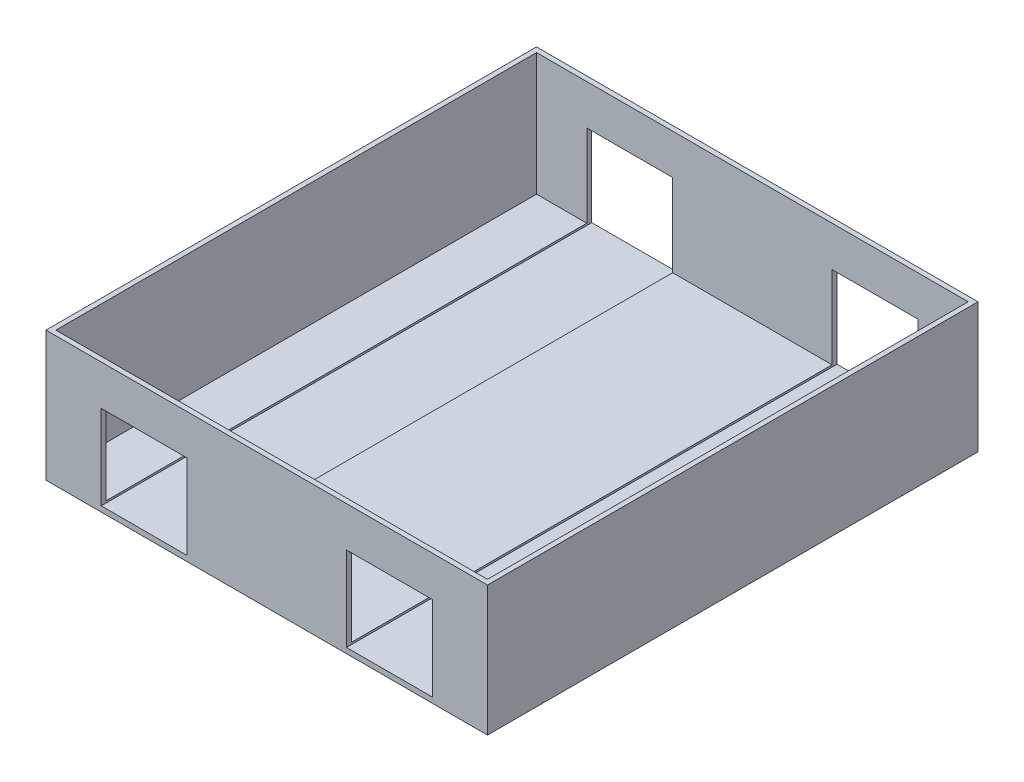
from build123d import *

# Parameters (mm, degrees)
SKETCH1_W               = 180
SKETCH1_H               = 200
BOSS_EXTRUDE1_DEPTH     = 3
SKETCH2_W               = 180
SKETCH2_H               = 200
SKETCH2_W_2             = 176
SKETCH2_H_2             = 196
BOSS_EXTRUDE2_DEPTH     = 50
CUT_EXTRUDE1_DEPTH      = 145.599446749
CUT_EXTRUDE1_DEPTH_BACK = 145.599446749
SKETCH3_W               = 34.985098544
SKETCH3_H               = 34.434974118


with BuildPart() as part:
    # Sketch1 → Boss-Extrude1 (new body)
    with BuildSketch(Plane(origin=(0, 0, 0), x_dir=(1, 0, 0), z_dir=(0, 1, 0))):
        Rectangle(SKETCH1_W, SKETCH1_H)
    extrude(amount=BOSS_EXTRUDE1_DEPTH)

    # Sketch2 → Boss-Extrude2 (add)
    with BuildSketch(Plane(origin=(0, 3, 0), x_dir=(1, 0, 0), z_dir=(0, 1, 0))):
        Rectangle(SKETCH2_W, SKETCH2_H)
        Rectangle(SKETCH2_W_2, SKETCH2_H_2, mode=Mode.SUBTRACT)
    extrude(amount=BOSS_EXTRUDE2_DEPTH)

    # Sketch3 → Cut-Extrude1 (cut, two sides: drawn at the far end of the back side and taken through both)
    with BuildSketch(Plane.XY.offset(-CUT_EXTRUDE1_DEPTH_BACK)):
        with Locations((-50, 19.417487059)):
            Rectangle(SKETCH3_W, SKETCH3_H)
        with Locations((50, 19.417487059)):
            Rectangle(SKETCH3_W, SKETCH3_H)
    extrude(amount=CUT_EXTRUDE1_DEPTH + CUT_EXTRUDE1_DEPTH_BACK, mode=Mode.SUBTRACT)


solid = part.part
